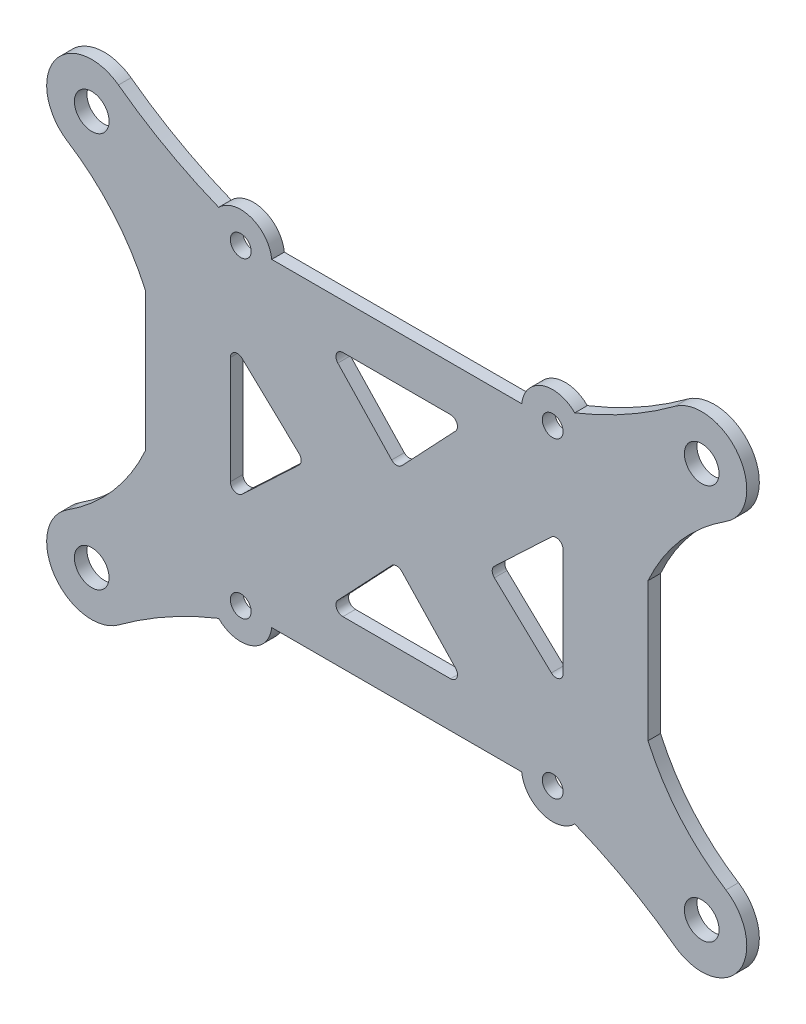
from build123d import *

# Parameters (mm, degrees)
SKETCH1_R           = 2.5
BOSS_EXTRUDE1_DEPTH = 1.813873007
SKETCH2_R           = 1.5
CUT_EXTRUDE1_DEPTH  = 62.469831099


with BuildPart() as part:
    # Sketch1 → Boss-Extrude1 (new body)
    with BuildSketch(Plane.XY):
        with BuildLine():
            Line((36.25, -10), (36.25, 10))
            ThreePointArc((36.25, 10), (40.919052696, 17.33292647), (47.494545324, 23.019292657))
            ThreePointArc((47.494545324, 23.019292657), (49.358557668, 32.179111268), (40.140588391, 33.730195219))
            ThreePointArc((40.140588391, 33.730195219), (33.169485012, 29.243195432), (25.683959799, 25.68))
            ThreePointArc((25.683959799, 25.68), (21.013241966, 26.747299206), (18.027864045, 23))
            Line((18.027864045, 23), (-18.027864045, 23))
            ThreePointArc((-18.027864045, 23), (-21.013241966, 26.747299206), (-25.683959799, 25.68))
            ThreePointArc((-25.683959799, 25.68), (-33.169485012, 29.243195432), (-40.140588391, 33.730195219))
            ThreePointArc((-40.140588391, 33.730195219), (-49.358557668, 32.179111268), (-47.494545324, 23.019292657))
            ThreePointArc((-47.494545324, 23.019292657), (-40.919052696, 17.33292647), (-36.25, 10))
            Line((-36.25, 10), (-36.25, -10))
            ThreePointArc((-36.25, -10), (-40.919052696, -17.33292647), (-47.494545324, -23.019292657))
            ThreePointArc((-47.494545324, -23.019292657), (-49.358557668, -32.179111268), (-40.140588391, -33.730195219))
            ThreePointArc((-40.140588391, -33.730195219), (-33.169485012, -29.243195432), (-25.683959799, -25.68))
            ThreePointArc((-25.683959799, -25.68), (-21.013241966, -26.747299206), (-18.027864045, -23))
            Line((-18.027864045, -23), (18.027864045, -23))
            ThreePointArc((18.027864045, -23), (21.013241966, -26.747299206), (25.683959799, -25.68))
            ThreePointArc((25.683959799, -25.68), (33.169485012, -29.243195432), (40.140588391, -33.730195219))
            ThreePointArc((40.140588391, -33.730195219), (49.358557668, -32.179111268), (47.494545324, -23.019292657))
            ThreePointArc((47.494545324, -23.019292657), (40.919052696, -17.33292647), (36.25, -10))
        make_face()
        with Locations((-44, -28.5)):
            Circle(SKETCH1_R, mode=Mode.SUBTRACT)
        with Locations(Location((-44, 28.5, 0), (0, 0, 180))):
            Circle(SKETCH1_R, mode=Mode.SUBTRACT)
        with Locations(Location((44, -28.5, 0), (0, 0, 180))):
            Circle(SKETCH1_R, mode=Mode.SUBTRACT)
        with Locations((44, 28.5)):
            Circle(SKETCH1_R, mode=Mode.SUBTRACT)
    extrude(amount=BOSS_EXTRUDE1_DEPTH)

    # Sketch2 → Cut-Extrude1 (cut, through all)
    with BuildSketch(Plane.XY.offset(1.813873007)):
        with Locations((-22.5, 22.5)):
            Circle(SKETCH2_R)
        with Locations(Location((-22.5, -22.5, 0), (0, 0, 180))):
            Circle(SKETCH2_R)
        with Locations((22.5, -22.5)):
            Circle(SKETCH2_R)
        with Locations(Location((22.5, 22.5, 0), (0, 0, 180))):
            Circle(SKETCH2_R)
        with BuildLine():
            Line((-7.765, 16.5), (7.765, 16.5))
            ThreePointArc((7.765, 16.5), (8.68337839, 15.89570334), (8.491810792, 14.813162266))
            Line((8.491810792, 14.813162266), (0.726810792, 6.596249413))
            ThreePointArc((0.726810792, 6.596249413), (0, 6.283087147), (-0.726810792, 6.596249413))
            Line((-0.726810792, 6.596249413), (-8.491810792, 14.813162266))
            ThreePointArc((-8.491810792, 14.813162266), (-8.68337839, 15.89570334), (-7.765, 16.5))
        make_face()
        with BuildLine():
            Line((-7.765, -16.5), (7.765, -16.5))
            ThreePointArc((7.765, -16.5), (8.68337839, -15.89570334), (8.491810792, -14.813162266))
            Line((8.491810792, -14.813162266), (0.726810792, -6.596249413))
            ThreePointArc((0.726810792, -6.596249413), (0, -6.283087147), (-0.726810792, -6.596249413))
            Line((-0.726810792, -6.596249413), (-8.491810792, -14.813162266))
            ThreePointArc((-8.491810792, -14.813162266), (-8.68337839, -15.89570334), (-7.765, -16.5))
        make_face()
        with BuildLine():
            Line((-24, -7.765), (-24, 7.765))
            ThreePointArc((-24, 7.765), (-23.395885369, 8.683299937), (-22.31345045, 8.492083019))
            Line((-22.31345045, 8.492083019), (-14.090009559, 0.727083019))
            ThreePointArc((-14.090009559, 0.727083019), (-13.776559109, 0), (-14.090009559, -0.727083019))
            Line((-14.090009559, -0.727083019), (-22.31345045, -8.492083019))
            ThreePointArc((-22.31345045, -8.492083019), (-23.395885369, -8.683299937), (-24, -7.765))
        make_face()
        with BuildLine():
            Line((24, -7.765), (24, 7.765))
            ThreePointArc((24, 7.765), (23.395885369, 8.683299937), (22.31345045, 8.492083019))
            Line((22.31345045, 8.492083019), (14.090009559, 0.727083019))
            ThreePointArc((14.090009559, 0.727083019), (13.776559109, 0), (14.090009559, -0.727083019))
            Line((14.090009559, -0.727083019), (22.31345045, -8.492083019))
            ThreePointArc((22.31345045, -8.492083019), (23.395885369, -8.683299937), (24, -7.765))
        make_face()
    extrude(amount=-CUT_EXTRUDE1_DEPTH, mode=Mode.SUBTRACT)


solid = part.part
